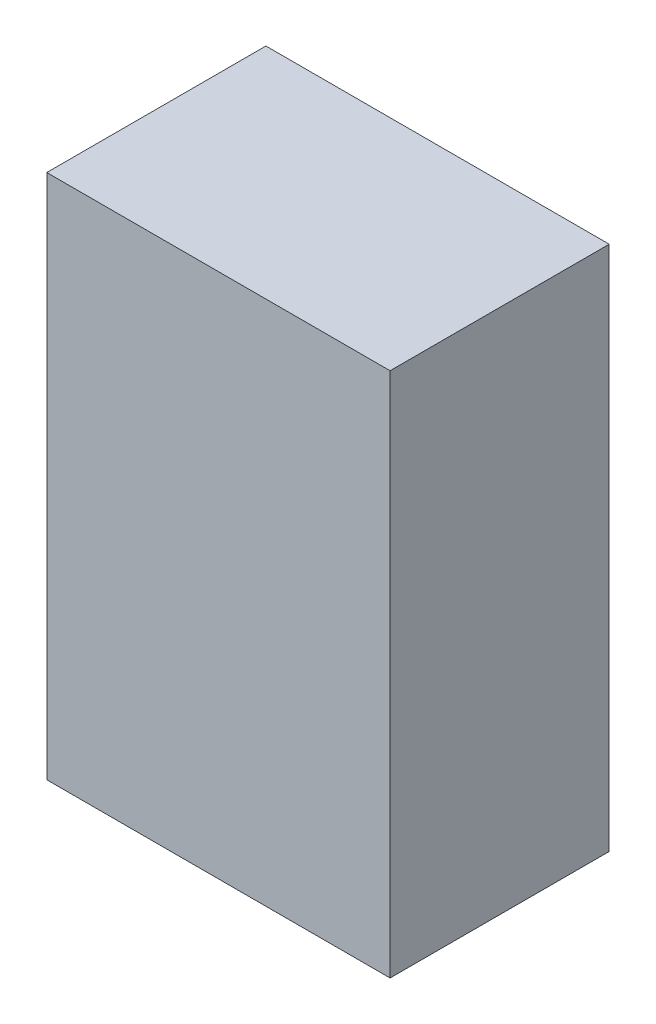
from build123d import *

# Parameters (mm, degrees)
SKETCH2_W           = 35.25
SKETCH2_H           = 22.5
BOSS_EXTRUDE1_DEPTH = 54


with BuildPart() as part:
    # Sketch2 → Boss-Extrude1 (new body)
    with BuildSketch(Plane(origin=(0, 0, 0), x_dir=(1, 0, 0), z_dir=(0, 1, 0))):
        with Locations((17.625, 11.25)):
            Rectangle(SKETCH2_W, SKETCH2_H)
    extrude(amount=BOSS_EXTRUDE1_DEPTH)


solid = part.part
